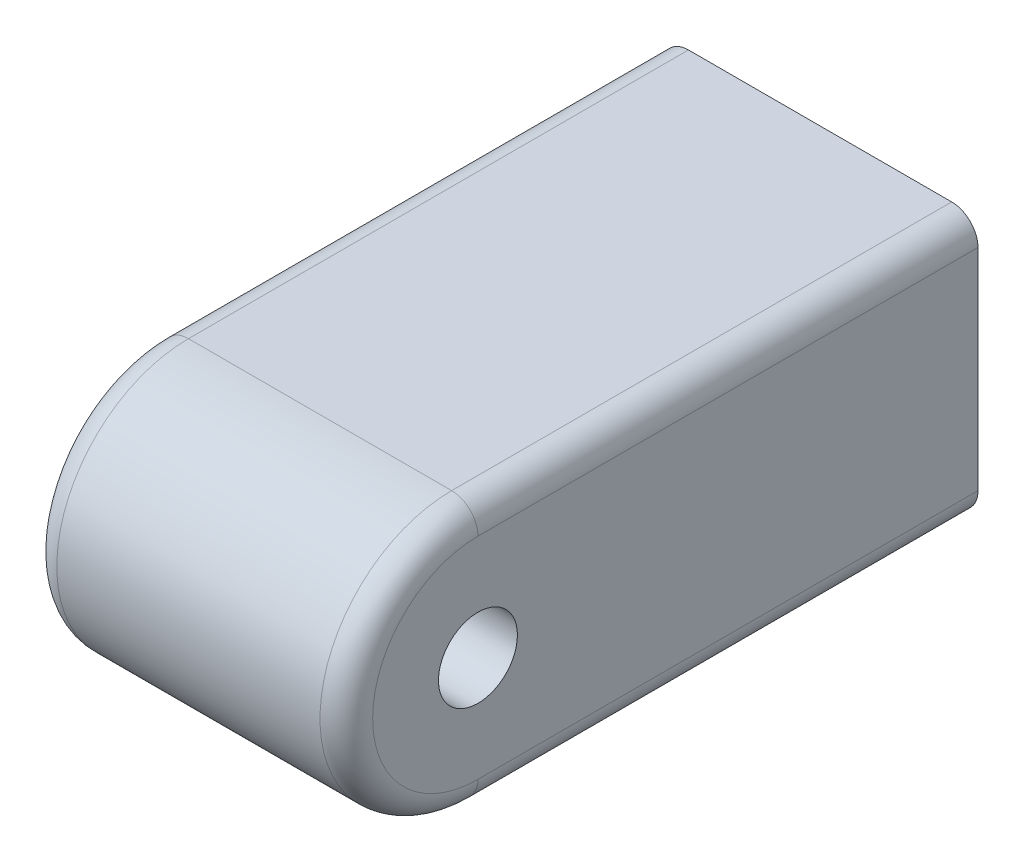
from build123d import *

# Parameters (mm, degrees)
BOSS_EXTRUDE1_DEPTH = 60
CUT_EXTRUDE1_REACH  = 90.459
SKETCH2_R           = 7.5
SKETCH3_W           = 50
SKETCH3_H           = 40
CUT_EXTRUDE2_DEPTH  = 70
SKETCH4_R           = 1.5
CUT_EXTRUDE3_DEPTH  = 10
FILLET2_R           = 5


with BuildPart() as part:
    # Sketch1 → Boss-Extrude1 (new body)
    with BuildSketch(Plane(origin=(0, 0, 0), x_dir=(0, 0, -1), z_dir=(1, 0, 0))):
        with BuildLine():
            Line((-35, 25), (60, 25))
            Line((60, 25), (60, -25))
            Line((60, -25), (-35, -25))
            ThreePointArc((-35, -25), (-60, 0), (-35, 25))
        make_face()
    extrude(amount=BOSS_EXTRUDE1_DEPTH)

    # Sketch2 → Cut-Extrude1 (cut, up to next)
    with BuildSketch(Plane(origin=(60, 0, 0), x_dir=(0, 0, -1), z_dir=(1, 0, 0)), mode=Mode.PRIVATE) as cut_extrude1_sk1:
        with Locations((-35, 0)):
            Circle(SKETCH2_R)
    cut_extrude1_tool1 = extrude(cut_extrude1_sk1.sketch, amount=-CUT_EXTRUDE1_REACH, mode=Mode.PRIVATE) & part.part
    add(cut_extrude1_tool1.solids().sort_by_distance((60, 0, 35))[0], mode=Mode.SUBTRACT)

    # Sketch3 → Cut-Extrude2 (cut)
    with BuildSketch(Plane(origin=(0, 0, -60), x_dir=(-1, 0, 0), z_dir=(0, 0, -1))):
        with Locations((-30, 0)):
            Rectangle(SKETCH3_W, SKETCH3_H)
    extrude(amount=-CUT_EXTRUDE2_DEPTH, mode=Mode.SUBTRACT)

    # Sketch4 → Cut-Extrude3 (cut)
    with BuildSketch(Plane(origin=(0, 0, -60), x_dir=(-1, 0, 0), z_dir=(0, 0, -1))):
        with Locations((-50, 22.5)):
            Circle(SKETCH4_R)
        with Locations((-50, -22.5)):
            Circle(SKETCH4_R)
        with Locations((-10, -22.5)):
            Circle(SKETCH4_R)
        with Locations((-10, 22.5)):
            Circle(SKETCH4_R)
        with Locations((-57.5, 0)):
            Circle(SKETCH4_R)
        with Locations((-2.5, 0)):
            Circle(SKETCH4_R)
    extrude(amount=-CUT_EXTRUDE3_DEPTH, mode=Mode.SUBTRACT)

    # Fillet2
    fillet2_edges = [part.edges().sort_by_distance(p)[0] for p in [
        (60, 25, -12.5),
        (60, 0, 60),
        (0, 25, -12.5),
        (0, -25, -12.5),
        (0, 0, 60),
        (60, -25, -12.5),
    ]]
    fillet(fillet2_edges, radius=FILLET2_R)


solid = part.part
